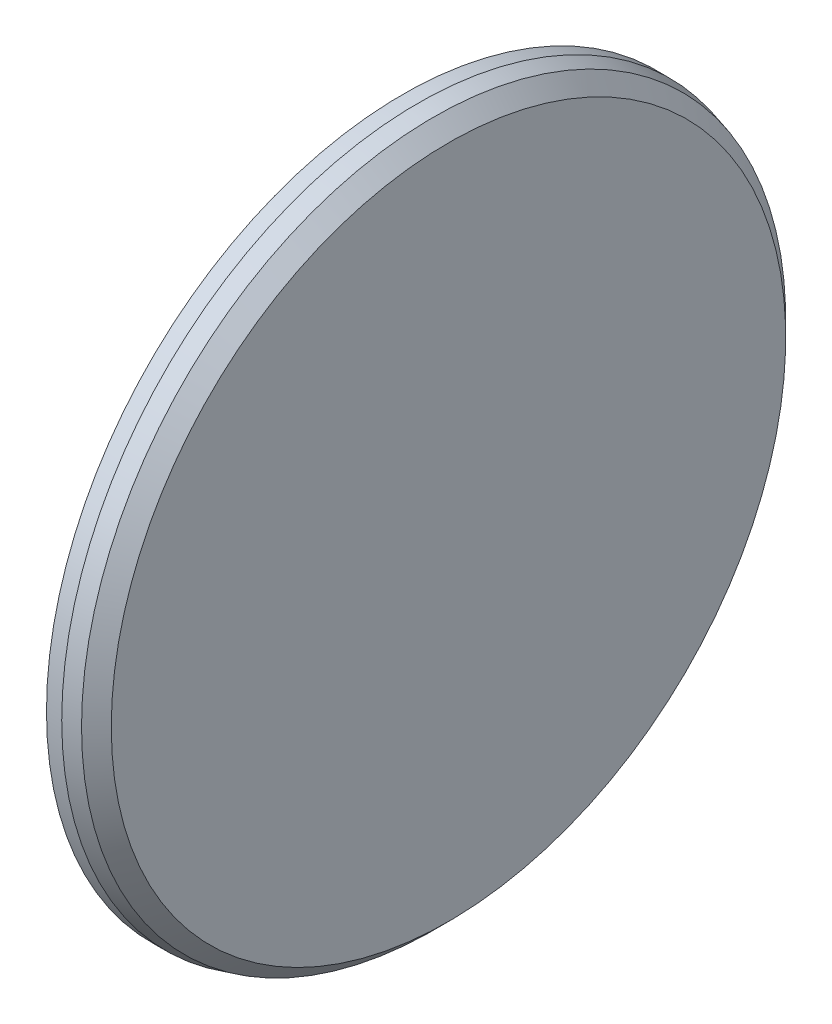
from build123d import *

# Parameters (mm, degrees)
SKETCH2_R           = 100
BOSS_EXTRUDE1_DEPTH = 20
SKETCH3_R           = 422.5
CUT_EXTRUDE1_DEPTH  = 30


with BuildPart() as part:
    # Sketch1 → Revolve1 (revolve)
    with BuildSketch(Plane(origin=(0, 0, 0), x_dir=(1, 0, 0), z_dir=(0, 1, 0)), mode=Mode.PRIVATE) as revolve1_sk:
        Polygon((0, 0), (60, 0), (60, 442.5), (40.490381057, 462.009618943), (20, 467.5), (0, 467.5), align=None)
    revolve(revolve1_sk.sketch.rotate(Axis((0, 0, 0), (1, 0, 0)), 180), axis=Axis((0, 0, 0), (1, 0, 0)))

    # Sketch2 → Boss-Extrude1 (add)
    with BuildSketch(Plane.ZY):
        Circle(SKETCH2_R)
    extrude(amount=BOSS_EXTRUDE1_DEPTH)

    # Sketch3 → Cut-Extrude1 (cut)
    with BuildSketch(Plane.ZY):
        Circle(SKETCH3_R)
    extrude(amount=-CUT_EXTRUDE1_DEPTH, mode=Mode.SUBTRACT)


with BuildPart() as cut_extrude1_piece_1:
    # of the separate pieces the step leaves, piece 1, a body of its own (cut_extrude1_pieces)
    add(part.part.solids().sort_by_distance((60, 0, 442.5))[0])


with BuildPart() as cut_extrude1_piece_2:
    # of the separate pieces the step leaves, piece 2, a body of its own (cut_extrude1_pieces)
    add(part.part.solids().sort_by_distance((0, 0, 100))[0])


solid = Compound([cut_extrude1_piece_1.part, cut_extrude1_piece_2.part])
